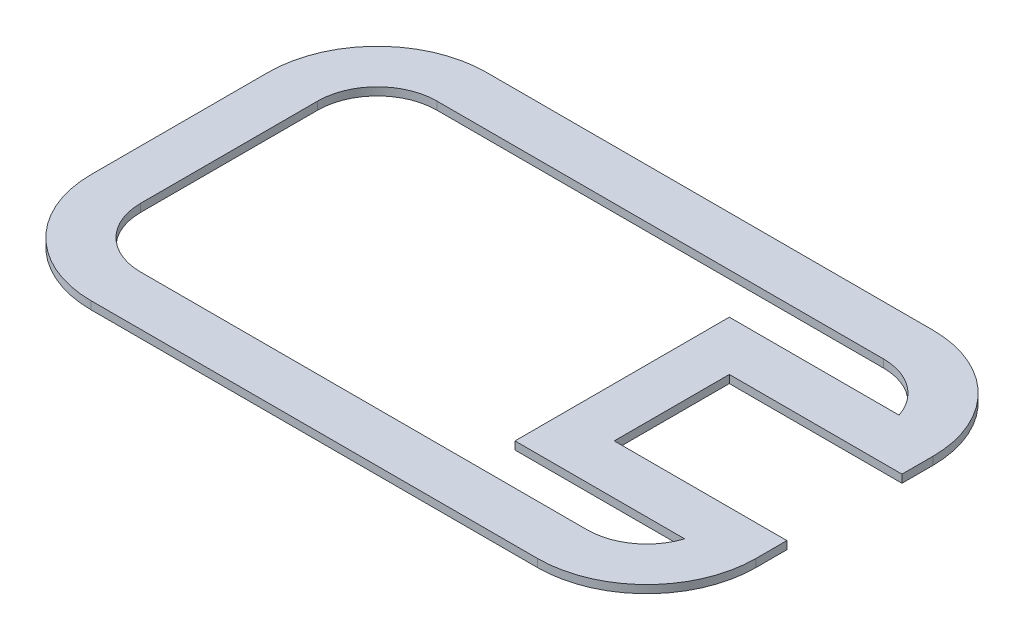
from build123d import *

# Parameters (mm, degrees)
BOSS_EXTRUDE1_DEPTH = 4


with BuildPart() as part:
    # Sketch1 → Boss-Extrude1 (new body)
    with BuildSketch(Plane(origin=(0, 0, 0), x_dir=(1, 0, 0), z_dir=(0, 1, 0))):
        with BuildLine():
            Line((281.992313692, -105.781584964), (281.992313692, -121.411584964))
            ThreePointArc((281.992313692, -121.411584964), (265.883186657, -160.302457929), (226.992313692, -176.411584964))
            Line((226.992313692, -176.411584964), (1.962313692, -176.411584964))
            ThreePointArc((1.962313692, -176.411584964), (-36.928559274, -160.302457929), (-53.037686308, -121.411584964))
            Line((-53.037686308, -121.411584964), (-53.037686308, -32.151584964))
            ThreePointArc((-53.037686308, -32.151584964), (-36.928559274, 6.739288001), (1.962313692, 22.848415036))
            Line((1.962313692, 22.848415036), (226.992313692, 22.848415036))
            ThreePointArc((226.992313692, 22.848415036), (265.883186657, 6.739288001), (281.992313692, -32.151584964))
            Line((281.992313692, -32.151584964), (281.992313692, -47.781584964))
            Line((281.992313692, -47.781584964), (194.992313692, -47.781584964))
            Line((194.992313692, -47.781584964), (194.992313692, -105.781584964))
            Line((194.992313692, -105.781584964), (281.992313692, -105.781584964))
        make_face()
        with BuildLine():
            Line((1.962313692, -151.411584964), (226.992313692, -151.411584964))
            ThreePointArc((226.992313692, -151.411584964), (244.583504669, -145.712819501), (255.491490873, -130.781584964))
            Line((255.491490873, -130.781584964), (169.992313692, -130.781584964))
            Line((169.992313692, -130.781584964), (169.992313692, -22.781584964))
            Line((169.992313692, -22.781584964), (255.491490873, -22.781584964))
            ThreePointArc((255.491490873, -22.781584964), (244.583504669, -7.850350427), (226.992313692, -2.151584964))
            Line((226.992313692, -2.151584964), (1.962313692, -2.151584964))
            ThreePointArc((1.962313692, -2.151584964), (-19.250889744, -10.938381528), (-28.037686308, -32.151584964))
            Line((-28.037686308, -32.151584964), (-28.037686308, -121.411584964))
            ThreePointArc((-28.037686308, -121.411584964), (-19.250889744, -142.6247884), (1.962313692, -151.411584964))
        make_face(mode=Mode.SUBTRACT)
    extrude(amount=BOSS_EXTRUDE1_DEPTH)


solid = part.part
